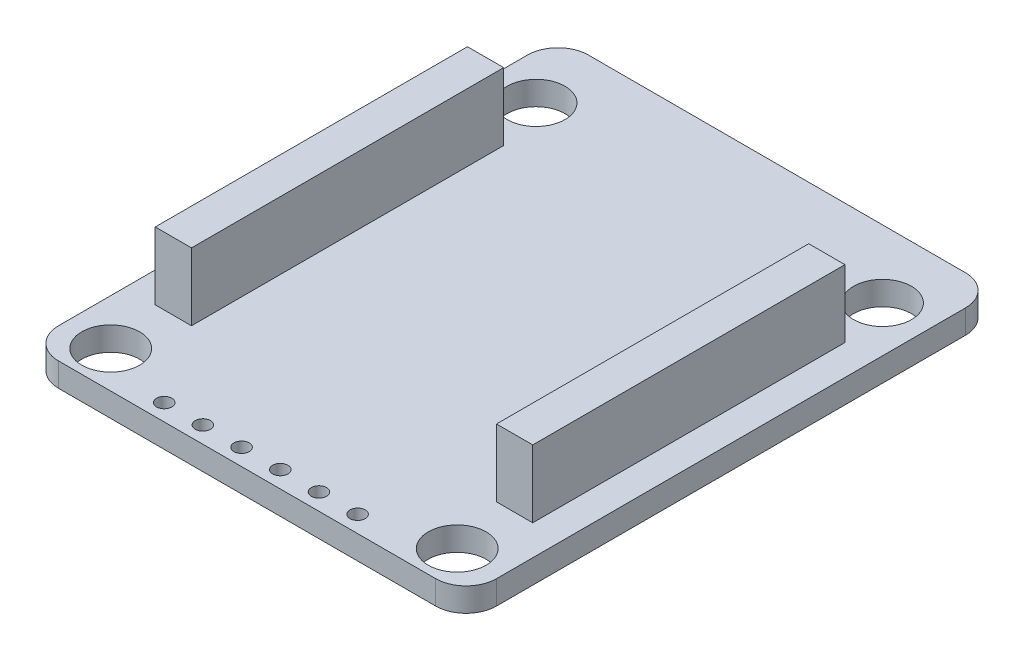
from build123d import *

# Parameters (mm, degrees)
SKETCH1_W                  = 28.76
SKETCH1_H                  = 34.79
PCB_DEPTH                  = 1.56
F_3_8_3_8_DIAMETER_HOLE4_D = 3.8
SKETCH7_W                  = 2.38
SKETCH7_H                  = 20.5
HEADERS_DEPTH              = 4.43
SKETCH8_R                  = 0.5
CUT_EXTRUDE1_DEPTH         = 23.999898369
FILLET1_R                  = 2


with BuildPart() as part:
    # Sketch1 → PCB (new body)
    with BuildSketch(Plane(origin=(0, 0, 0), x_dir=(1, 0, 0), z_dir=(0, 1, 0))):
        Rectangle(SKETCH1_W, SKETCH1_H)
    extrude(amount=PCB_DEPTH)

    # Ø3.8 (3.8) Diameter Hole4 (through all)
    with Locations(Plane(origin=(0, 1.56, 0), x_dir=(1, 0, 0), z_dir=(0, 1, 0))):
        with Locations((-11.375, 12.955), (11.375, 12.955), (-11.375, -14.975), (11.375, -14.975)):
            Hole(F_3_8_3_8_DIAMETER_HOLE4_D / 2)

    # Sketch7 → Headers (add)
    with BuildSketch(Plane(origin=(0, 1.56, 0), x_dir=(1, 0, 0), z_dir=(0, 1, 0))):
        with Locations((-11.203491178, -0.781399088)):
            Rectangle(SKETCH7_W, SKETCH7_H)
    headers = extrude(amount=HEADERS_DEPTH)

    # Sketch8 → Cut-Extrude1 (cut, through all)
    with BuildSketch(Plane(origin=(0, 1.56, 0), x_dir=(1, 0, 0), z_dir=(0, 1, 0))):
        with Locations(Location((-6.541275499, -16.295, 0), (0, 0, 270))):
            Circle(SKETCH8_R)
        with Locations(Location((-4.001275499, -16.295, 0), (0, 0, 270))):
            Circle(SKETCH8_R)
        with Locations(Location((-1.461275499, -16.295, 0), (0, 0, 270))):
            Circle(SKETCH8_R)
        with Locations(Location((1.078724501, -16.295, 0), (0, 0, 270))):
            Circle(SKETCH8_R)
        with Locations(Location((3.618724501, -16.295, 0), (0, 0, 270))):
            Circle(SKETCH8_R)
        with Locations(Location((6.158724501, -16.295, 0), (0, 0, 270))):
            Circle(SKETCH8_R)
    extrude(amount=-CUT_EXTRUDE1_DEPTH, mode=Mode.SUBTRACT)

    # Mirror1: Headers across plane
    add(headers.mirror(Plane(origin=(0, 0, 0), x_dir=(0, 0, 1), z_dir=(1, 0, 0))))

    # Fillet1
    fillet1_edges = [part.edges().sort_by_distance(p)[0] for p in [
        (14.38, 0.78, 17.395),
        (-14.38, 0.78, 17.395),
        (-14.38, 0.78, -17.395),
        (14.38, 0.78, -17.395),
    ]]
    fillet(fillet1_edges, radius=FILLET1_R)


solid = part.part
